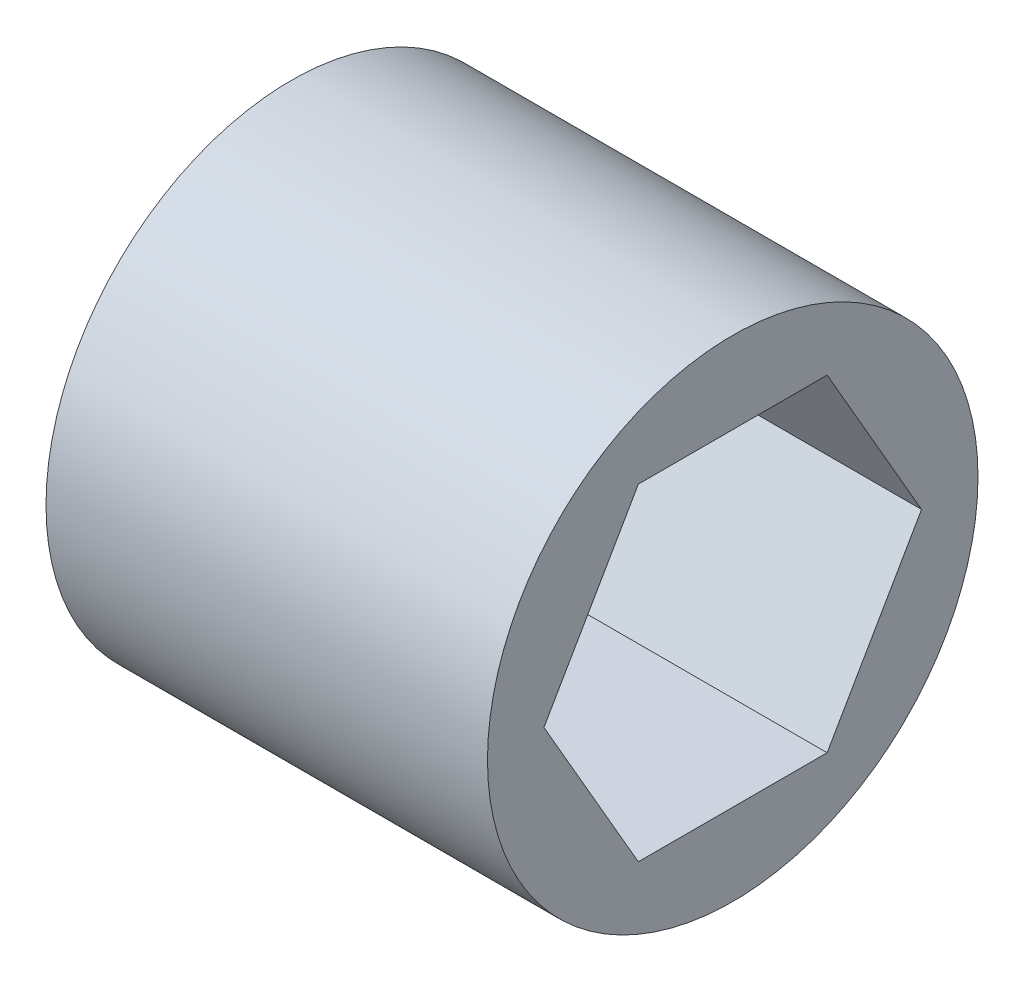
from build123d import *

# Parameters (mm, degrees)
SKETCH1_R           = 9.525
BOSS_EXTRUDE1_DEPTH = 17.145


with BuildPart() as part:
    # Sketch1 → Boss-Extrude1 (new body)
    with BuildSketch(Plane(origin=(0, 0, 0), x_dir=(0, 0, -1), z_dir=(1, 0, 0))):
        Circle(SKETCH1_R)
        Polygon((7.332348419, 0), (3.666174209, 6.35), (-3.666174209, 6.35), (-7.332348419, 0), (-3.666174209, -6.35), (3.666174209, -6.35), align=None, mode=Mode.SUBTRACT)
    extrude(amount=BOSS_EXTRUDE1_DEPTH)


solid = part.part
